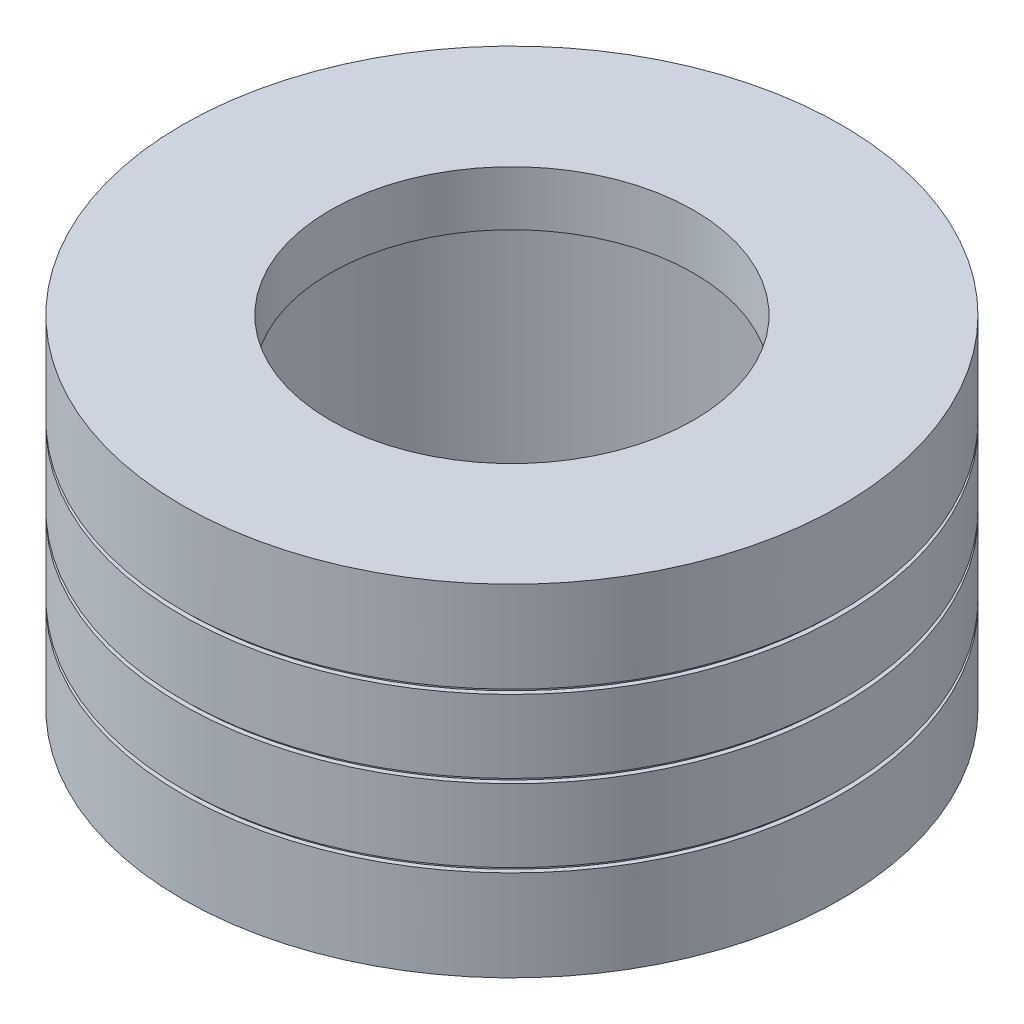
from build123d import *

# Parameters (mm, degrees)
SKETCH_1_R          = 7.25
EXTRUDE_1_DEPTH     = 7.5
SKETCH_2_R          = 6.4
CUT_EXTRUDE_1_DEPTH = 6.3
SKETCH_4_R          = 4
CUT_EXTRUDE_2_DEPTH = 1.2
SKETCH_3_W          = 0.1
SKETCH_3_H          = 0.1


with BuildPart() as part:
    # ｽｹｯﾁ1 → ﾎﾞｽ - 押し出し1 (new body)
    with BuildSketch(Plane(origin=(0, 0, 0), x_dir=(1, 0, 0), z_dir=(0, 1, 0))):
        with Locations(Location((0, 0, 0), (0, 0, 270))):
            Circle(SKETCH_1_R)
    extrude(amount=EXTRUDE_1_DEPTH)

    # ｽｹｯﾁ2 → ｶｯﾄ - 押し出し1 (cut)
    with BuildSketch(Plane.XZ):
        with Locations(Location((0, 0, 0), (0, 0, 270))):
            Circle(SKETCH_2_R)
    extrude(amount=-CUT_EXTRUDE_1_DEPTH, mode=Mode.SUBTRACT)

    # ｽｹｯﾁ4 → ｶｯﾄ - 押し出し2 (cut)
    with BuildSketch(Plane(origin=(0, 7.5, 0), x_dir=(1, 0, 0), z_dir=(0, 1, 0))):
        with Locations(Location((0, 0, 0), (0, 0, 270))):
            Circle(SKETCH_4_R)
    extrude(amount=-CUT_EXTRUDE_2_DEPTH, mode=Mode.SUBTRACT)

    # ｽｹｯﾁ3 → ｶｯﾄ - 回転1 (revolve, cut)
    with BuildSketch(Plane.XY):
        with Locations((-7.2, 5.45)):
            Rectangle(SKETCH_3_W, SKETCH_3_H)
        with Locations((-7.2, 3.75)):
            Rectangle(SKETCH_3_W, SKETCH_3_H)
        with Locations((-7.2, 2.05)):
            Rectangle(SKETCH_3_W, SKETCH_3_H)
    revolve(axis=Axis((0, 7.5, 0), (0, -1, 0)), mode=Mode.SUBTRACT)


solid = part.part
